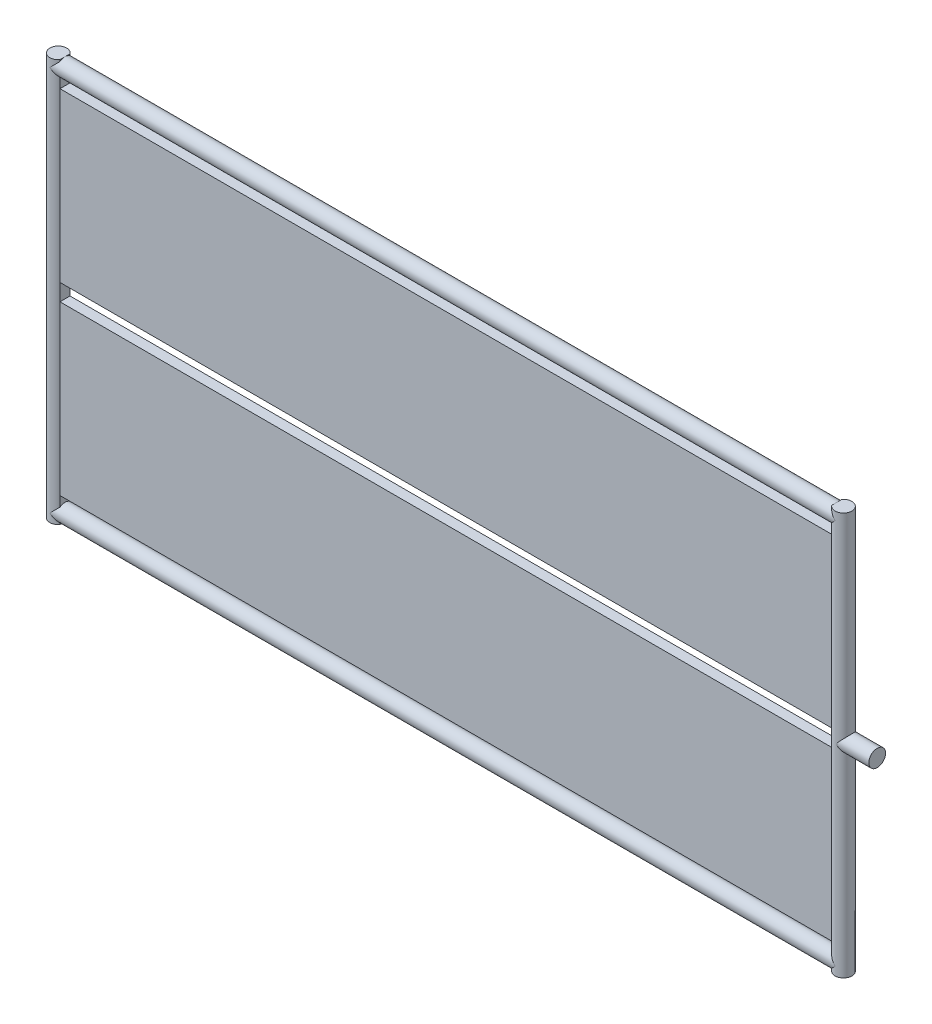
from build123d import *

# Parameters (mm, degrees)
SKETCH1_W                = 23000
SKETCH1_H                = 5000
BOSS_EXTRUDE1_DEPTH      = 300
BOSS_EXTRUDE1_2_DEPTH    = 300
BOSS_EXTRUDE2_DEPTH      = 6000
BOSS_EXTRUDE2_DEPTH_BACK = 6000
BOSS_EXTRUDE3_DEPTH      = 23194.882000034
BOSS_EXTRUDE3_DEPTH_BACK = 199.962000126
SKETCH4_R                = 250
BOSS_EXTRUDE4_START      = -199.962000126
SKETCH5_R                = 250
BOSS_EXTRUDE4_DEPTH      = 1000


with BuildPart() as part:
    # Sketch1 → Boss-Extrude1 (new body)
    with BuildSketch(Plane.XY):
        with Locations((0, 2750)):
            Rectangle(SKETCH1_W, SKETCH1_H)
    extrude(amount=BOSS_EXTRUDE1_DEPTH)

    # Sketch2 → Boss-Extrude2 (add, two sides: drawn at the far end of the back side and taken through both)
    with BuildSketch(Plane(origin=(0, 0, 0), x_dir=(1, 0, 0), z_dir=(0, 1, 0)).offset(-BOSS_EXTRUDE2_DEPTH_BACK)):
        with BuildLine():
            ThreePointArc((11500, 0), (11950, -150), (11500, -300))
            Line((11500, -300), (11500, 0))
        make_face()
        with BuildLine():
            ThreePointArc((-11500, 0), (-11950, -150), (-11500, -300))
            Line((-11500, -300), (-11500, 0))
        make_face()
    extrude(amount=BOSS_EXTRUDE2_DEPTH + BOSS_EXTRUDE2_DEPTH_BACK)

    # Sketch4 → Boss-Extrude3 (add, two sides: drawn at the far end of the back side and taken through both)
    with BuildSketch(Plane(origin=(-11500, 0, 0), x_dir=(0, 0, -1), z_dir=(1, 0, 0)).offset(-BOSS_EXTRUDE3_DEPTH_BACK)):
        with Locations(Location((-150, 5750, 0), (0, 0, 306.869897646))):
            Circle(SKETCH4_R)
        with Locations(Location((-150, -5750, 0), (0, 0, 306.869897646))):
            Circle(SKETCH4_R)
    extrude(amount=BOSS_EXTRUDE3_DEPTH + BOSS_EXTRUDE3_DEPTH_BACK)

    # Sketch5 → Boss-Extrude4 (add)
    with BuildSketch(Plane.ZY.offset(-11500).offset(BOSS_EXTRUDE4_START)):
        with Locations((145.764474573, 0)):
            Circle(SKETCH5_R)
    extrude(amount=-BOSS_EXTRUDE4_DEPTH)


with BuildPart() as body_2:
    # Sketch1 → Boss-Extrude1 2 (new body)
    with BuildSketch(Plane.XY):
        with Locations((0, -2750)):
            Rectangle(SKETCH1_W, SKETCH1_H)
    extrude(amount=BOSS_EXTRUDE1_2_DEPTH)


solid = Compound([part.part, body_2.part])
